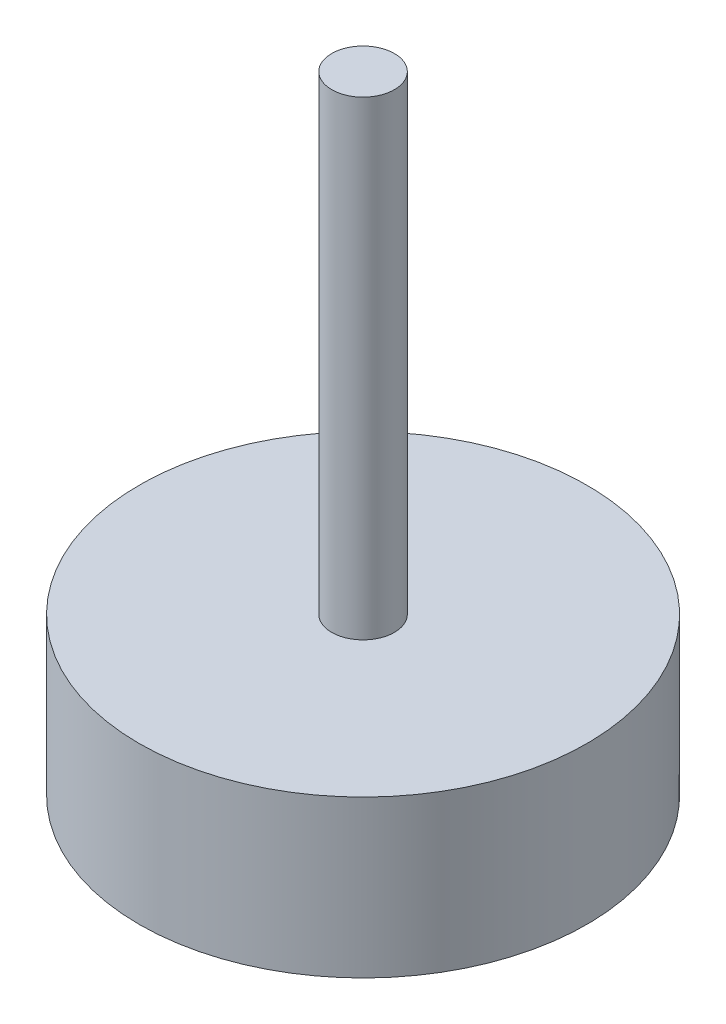
from build123d import *

# Parameters (mm, degrees)
ESQUISSE1_R             = 5
BOSS_EXTRU_1_DEPTH      = 14
ENL_V_START             = -10.5
ESQUISSE2_R             = 5
ESQUISSE2_R_2           = 0.7
ENL_V_MAT_EXTRU_1_DEPTH = 10.5


with BuildPart() as part:
    # Esquisse1 → Boss.-Extru.1 (new body)
    with BuildSketch(Plane(origin=(0, 0, 0), x_dir=(1, 0, 0), z_dir=(0, 1, 0))):
        with Locations(Location((0, 0, 0), (0, 0, 270))):
            Circle(ESQUISSE1_R)
    extrude(amount=BOSS_EXTRU_1_DEPTH)

    # Esquisse2 → Enlèv. mat.-Extru.1 (cut)
    with BuildSketch(Plane(origin=(0, 14, 0), x_dir=(1, 0, 0), z_dir=(0, 1, 0)).offset(ENL_V_START)):
        with Locations(Location((0, 0, 0), (0, 0, 270))):
            Circle(ESQUISSE2_R)
        with Locations(Location((0, 0, 0), (0, 0, 270))):
            Circle(ESQUISSE2_R_2, mode=Mode.SUBTRACT)
    extrude(amount=ENL_V_MAT_EXTRU_1_DEPTH, mode=Mode.SUBTRACT)


solid = part.part
